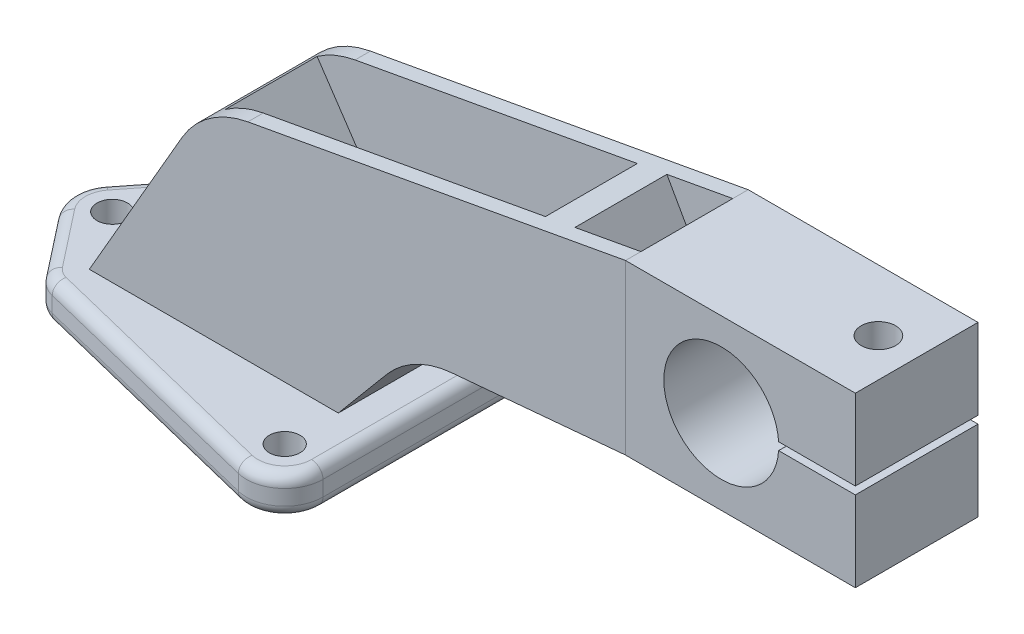
from build123d import *

# Parameters (mm, degrees)
BOSS_EXTRUDE1_DEPTH      = 4
BOSS_EXTRUDE2_DEPTH      = 0.01
BOSS_EXTRUDE2_DEPTH_BACK = 32.01
SKETCH4_R                = 4.5
CUT_EXTRUDE1_DEPTH       = 23
CUT_EXTRUDE2_DEPTH       = 217.234410074
CUT_EXTRUDE2_DEPTH_BACK  = 217.234410074
SKETCH5_R                = 4
SKETCH6_R                = 4
BOSS_EXTRUDE3_DEPTH      = 10
FILLET1_R                = 3
BOSS_EXTRUDE6_DEPTH      = 24


with BuildPart() as part:
    # Sketch2 → Boss-Extrude1 (new body)
    with BuildSketch(Plane.XY.offset(16)):
        with BuildLine():
            Line((10, 0), (34.214158147, 41.940152173))
            ThreePointArc((34.214158147, 41.940152173), (41.467493607, 49.878296982), (51.384329922, 54.035384403))
            Line((51.384329922, 54.035384403), (150, 72))
            Line((150, 72), (150, 28))
            Line((150, 28), (104.559799809, 23.906962122))
            ThreePointArc((104.559799809, 23.906962122), (95.230440402, 21.168208391), (87.651490086, 15.077458761))
            Line((87.651490086, 15.077458761), (75, 0))
            Line((75, 0), (10, 0))
        make_face()
    extrude(amount=-BOSS_EXTRUDE1_DEPTH)


with BuildPart() as body_2:
    # Mirror2: mirrored copy
    add(part.part.mirror(Plane.XY))


with BuildPart() as part_1:
    add(part.part)

    add(body_2.part)  # Boss-Extrude2 merges body 2
    # Sketch3 → Boss-Extrude2 (add, two sides: drawn at the far end of the back side and taken through both)
    with BuildSketch(Plane.XY.offset(16).offset(-BOSS_EXTRUDE2_DEPTH_BACK)):
        with BuildLine():
            Line((189.966629547, 51), (210, 51))
            Line((210, 51), (210, 72))
            Line((210, 72), (150, 72))
            Line((150, 72), (150, 28))
            Line((150, 28), (210, 28))
            Line((210, 28), (210, 49))
            Line((210, 49), (189.966629547, 49))
            ThreePointArc((189.966629547, 49), (160, 50), (189.966629547, 51))
        make_face()
    extrude(amount=BOSS_EXTRUDE2_DEPTH + BOSS_EXTRUDE2_DEPTH_BACK)

    # Sketch4 → Cut-Extrude1 (cut)
    with BuildSketch(Plane(origin=(0, 72, 0), x_dir=(1, 0, 0), z_dir=(0, 1, 0))):
        with Locations(Location((200, 0.005, 0), (0, 0, 270))):
            Circle(SKETCH4_R)
    extrude(amount=-CUT_EXTRUDE1_DEPTH, mode=Mode.SUBTRACT)

    # Sketch5 → Cut-Extrude2 (cut, two sides: drawn at the far end of the back side and taken through both)
    with BuildSketch(Plane(origin=(0, 49, 0), x_dir=(1, 0, 0), z_dir=(0, 1, 0)).offset(-CUT_EXTRUDE2_DEPTH_BACK)):
        with Locations(Location((200, 0.005, 0), (0, 0, 180))):
            Circle(SKETCH5_R)
    extrude(amount=CUT_EXTRUDE2_DEPTH + CUT_EXTRUDE2_DEPTH_BACK, mode=Mode.SUBTRACT)

    # Sketch6 → Boss-Extrude3 (add)
    with BuildSketch(Plane(origin=(0, 0, 0), x_dir=(1, 0, 0), z_dir=(0, 1, 0))):
        with BuildLine():
            Line((-7.870410355, 6.169006472), (3.703671716, 20.935205177))
            ThreePointArc((3.703671716, 20.935205177), (5.655280169, 22.717396042), (8.081072691, 23.766448222))
            Line((8.081072691, 23.766448222), (72.601340863, 39.708060277))
            ThreePointArc((72.601340863, 39.708060277), (81.164957771, 37.873582138), (85, 30))
            Line((85, 30), (85, -30))
            ThreePointArc((85, -30), (81.164957771, -37.873582138), (72.601340863, -39.708060277))
            Line((72.601340863, -39.708060277), (8.081072691, -23.766448222))
            ThreePointArc((8.081072691, -23.766448222), (5.655280169, -22.717396042), (3.703671716, -20.935205177))
            Line((3.703671716, -20.935205177), (-7.870410355, -6.169006472))
            ThreePointArc((-7.870410355, -6.169006472), (-10, 0), (-7.870410355, 6.169006472))
        make_face()
        with Locations(Location((75, 30, 0), (0, 0, 270))):
            Circle(SKETCH6_R, mode=Mode.SUBTRACT)
        with Locations(Location((75, -30, 0), (0, 0, 270))):
            Circle(SKETCH6_R, mode=Mode.SUBTRACT)
        with Locations(Location((0, 0, 0), (0, 0, 270))):
            Circle(SKETCH6_R, mode=Mode.SUBTRACT)
    extrude(amount=-BOSS_EXTRUDE3_DEPTH)

    # Fillet1
    fillet1_edges = [part_1.edges().sort_by_distance(p)[0] for p in [
        (5.655280169, 0, -22.717396042),
        (-2.083369319, 0, -13.552105825),
        (-10, 0, 0),
        (-2.083369319, 0, 13.552105825),
        (5.655280169, 0, 22.717396042),
        (40.341206777, 0, 31.73725425),
        (81.164957771, 0, 37.873582138),
        (85, 0, 0),
        (81.164957771, 0, -37.873582138),
        (40.341206777, 0, -31.73725425),
        (5.655280169, -10, -22.717396042),
        (40.341206777, -10, -31.73725425),
        (81.164957771, -10, -37.873582138),
        (85, -10, 0),
        (81.164957771, -10, 37.873582138),
        (40.341206777, -10, 31.73725425),
        (5.655280169, -10, 22.717396042),
        (-2.083369319, -10, 13.552105825),
        (-10, -10, 0),
        (-2.083369319, -10, -13.552105825),
    ]]
    fillet(fillet1_edges, radius=FILLET1_R)

    # Sketch9 → Boss-Extrude6 (add)
    with BuildSketch(Plane(origin=(0, 0, 12), x_dir=(-1, 0, 0), z_dir=(0, 0, -1))):
        with BuildLine():
            Line((-75, 0), (-68.975115859, 0))
            Line((-68.975115859, 0), (-37.662167154, 46.576791386))
            ThreePointArc((-37.662167154, 46.576791386), (-39.481454935, 48.323643003), (-41.467493607, 49.878296982))
            Line((-41.467493607, 49.878296982), (-72.096679368, 4.31857634))
            Line((-72.096679368, 4.31857634), (-125.078747354, 67.460146206))
            Line((-125.078747354, 67.460146206), (-132.783511462, 68.863707378))
            Line((-132.783511462, 68.863707378), (-150, 38.210356026))
            Line((-150, 38.210356026), (-150, 28))
            Line((-150, 28), (-129.348247033, 64.769718653))
            Line((-129.348247033, 64.769718653), (-75, 0))
        make_face()
    extrude(amount=BOSS_EXTRUDE6_DEPTH)


solid = part_1.part
